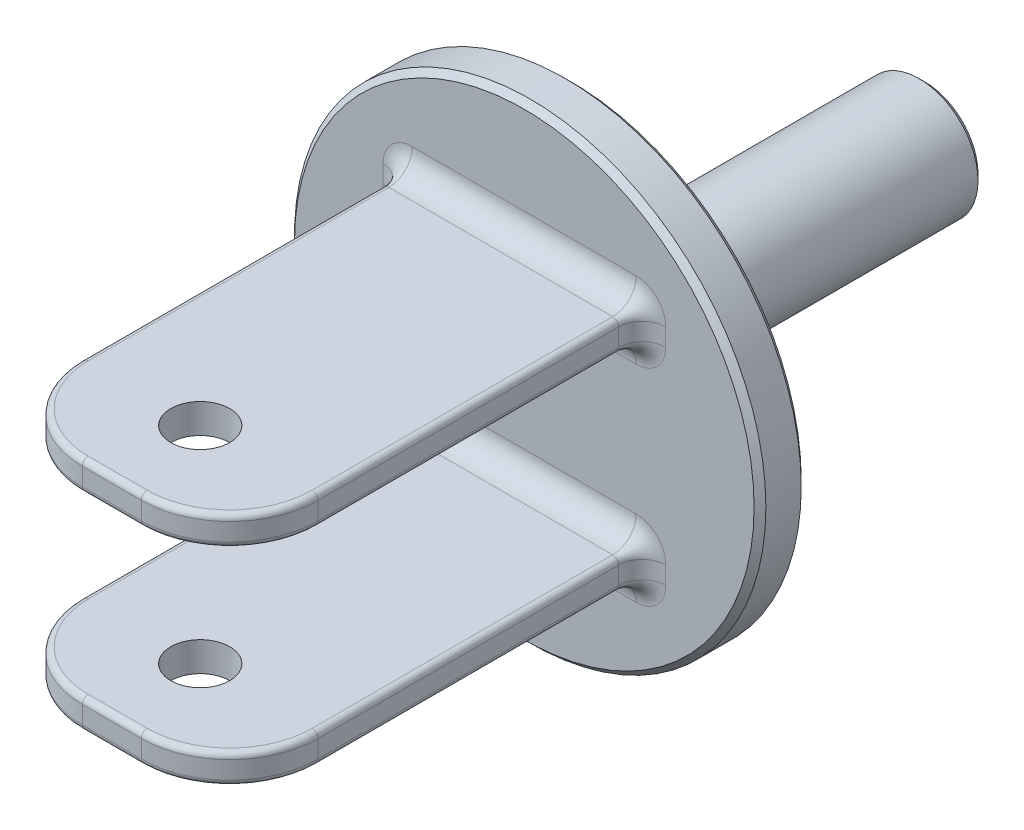
from build123d import *

# Parameters (mm, degrees)
SKETCH1_R            = 40
BOSS_EXTRUDE1_DEPTH  = 8
SKETCH2_W            = 40
SKETCH2_H            = 5
BOSS_EXTRUDE2_DEPTH  = 70
FILLET1_R            = 15
FILLET2_R            = 1
FILLET3_R            = 4
FILLET1_OF_MIRROR1_R = 15
FILLET2_OF_MIRROR1_R = 1
FILLET3_OF_MIRROR1_R = 4
SKETCH3_R            = 5
CUT_EXTRUDE1_DEPTH   = 107.226173873
SKETCH4_R            = 10
SKETCH4_R_2          = 7.5
BOSS_EXTRUDE3_DEPTH  = 60
CHAMFER1_SIZE        = 1
CHAMFER2_SIZE        = 1


with BuildPart() as part:
    # Sketch1 → Boss-Extrude1 (new body)
    with BuildSketch(Plane.XY):
        Circle(SKETCH1_R)
    extrude(amount=BOSS_EXTRUDE1_DEPTH)

    # Sketch2 → Boss-Extrude2 (add)
    with BuildSketch(Plane.XY.offset(8)):
        with Locations((0, 17.5)):
            Rectangle(SKETCH2_W, SKETCH2_H)
    boss_extrude2 = extrude(amount=BOSS_EXTRUDE2_DEPTH)

    # Fillet1
    fillet1_edges = [part.edges().sort_by_distance(p)[0] for p in [
        (-20, 17.5, 78),
        (20, 17.5, 78),
    ]]
    fillet(fillet1_edges, radius=FILLET1_R)

    # Fillet2
    fillet2_edges = [part.edges().sort_by_distance(p)[0] for p in [
        (0, 15, 78),
        (0, 20, 78),
        (-20, 20, 35.5),
        (20, 20, 35.5),
        (-15.606601718, 20, 73.606601718),
        (15.606601718, 20, 73.606601718),
        (20, 15, 35.5),
        (-20, 15, 35.5),
        (-15.606601718, 15, 73.606601718),
        (15.606601718, 15, 73.606601718),
    ]]
    fillet(fillet2_edges, radius=FILLET2_R)

    # Fillet3
    fillet3_edges = [part.edges().sort_by_distance(p)[0] for p in [
        (0, 20, 8),
        (20, 17.5, 8),
        (0, 15, 8),
        (-20, 17.5, 8),
        (19.707106781, 19.707106781, 8),
        (19.707106781, 15.292893219, 8),
        (-19.707106781, 19.707106781, 8),
        (-19.707106781, 15.292893219, 8),
    ]]
    fillet(fillet3_edges, radius=FILLET3_R)

    # Mirror1: Boss-Extrude2 across plane
    add(boss_extrude2.mirror(Plane.ZX))

    # Fillet1 of Mirror1
    fillet1_of_mirror1_edges = [part.edges().sort_by_distance(p)[0] for p in [
        (-20, -17.5, 78),
        (20, -17.5, 78),
    ]]
    fillet(fillet1_of_mirror1_edges, radius=FILLET1_OF_MIRROR1_R)

    # Fillet2 of Mirror1
    fillet2_of_mirror1_edges = [part.edges().sort_by_distance(p)[0] for p in [
        (0, -15, 78),
        (0, -20, 78),
        (-20, -20, 35.5),
        (20, -20, 35.5),
        (-15.606601718, -20, 73.606601718),
        (15.606601718, -20, 73.606601718),
        (20, -15, 35.5),
        (-20, -15, 35.5),
        (-15.606601718, -15, 73.606601718),
        (15.606601718, -15, 73.606601718),
    ]]
    fillet(fillet2_of_mirror1_edges, radius=FILLET2_OF_MIRROR1_R)

    # Fillet3 of Mirror1
    fillet3_of_mirror1_edges = [part.edges().sort_by_distance(p)[0] for p in [
        (0, -20, 8),
        (20, -17.5, 8),
        (0, -15, 8),
        (-20, -17.5, 8),
        (19.707106781, -19.707106781, 8),
        (19.707106781, -15.292893219, 8),
        (-19.707106781, -19.707106781, 8),
        (-19.707106781, -15.292893219, 8),
    ]]
    fillet(fillet3_of_mirror1_edges, radius=FILLET3_OF_MIRROR1_R)

    # Sketch3 → Cut-Extrude1 (cut, through all)
    with BuildSketch(Plane(origin=(0, 20, 0), x_dir=(1, 0, 0), z_dir=(0, 1, 0))):
        with Locations(Location((0, -63, 0), (0, 0, 180))):
            Circle(SKETCH3_R)
    extrude(amount=-CUT_EXTRUDE1_DEPTH, mode=Mode.SUBTRACT)

    # Sketch4 → Boss-Extrude3 (add)
    with BuildSketch(Plane(origin=(0, 0, 0), x_dir=(-1, 0, 0), z_dir=(0, 0, -1))):
        with Locations(Location((0, 0, 0), (0, 0, 180))):
            Circle(SKETCH4_R)
        with Locations(Location((0, 0, 0), (0, 0, 180))):
            Circle(SKETCH4_R_2, mode=Mode.SUBTRACT)
    extrude(amount=BOSS_EXTRUDE3_DEPTH)

    # Chamfer1
    chamfer1_edges = [part.edges().sort_by_distance(p)[0] for p in [
        (-10, 0, -60),
    ]]
    chamfer(chamfer1_edges, length=CHAMFER1_SIZE)

    # Chamfer2
    chamfer2_edges = [part.edges().sort_by_distance(p)[0] for p in [
        (-40, 0, 0),
        (-40, 0, 8),
    ]]
    chamfer(chamfer2_edges, length=CHAMFER2_SIZE)


solid = part.part
